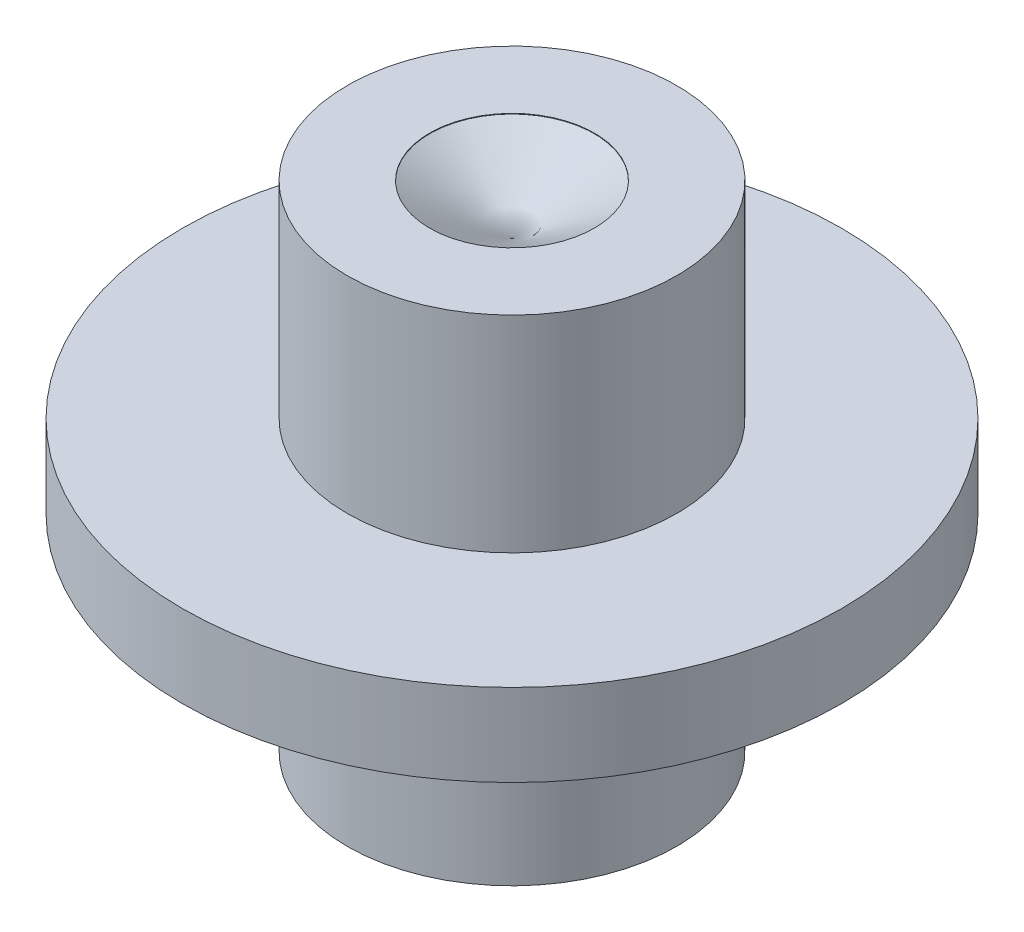
from build123d import *

# Parameters (mm, degrees)
F_1_8_0_125_DIAMETER_HOLE1_D     = 3.175
F_1_8_0_125_DIAMETER_HOLE1_DEPTH = 0.011333767
F_1_8_0_125_DIAMETER_HOLE1_TIP   = 0.953866233


with BuildPart() as part:
    # Sketch1 → Revolve1 (revolve)
    with BuildSketch(Plane.XY, mode=Mode.PRIVATE) as revolve1_sk:
        Polygon((0, 4.7625), (3.175, 4.7625), (3.175, 0.79375), (6.35, 0.79375), (6.35, -0.79375), (3.175, -0.79375), (3.175, -4.7625), (0, -4.7625), align=None)
    revolve(revolve1_sk.sketch.rotate(Axis((0, 4.7625, 0), (0, -1, 0)), 90), axis=Axis((0, 4.7625, 0), (0, -1, 0)))

    # 1/8 (0.125) Diameter Hole1
    with Locations(Plane(origin=(0, 4.7625, 0), x_dir=(1, 0, 0), z_dir=(0, 1, 0))):
        with Locations((0, 0)):
            Hole(F_1_8_0_125_DIAMETER_HOLE1_D / 2, depth=F_1_8_0_125_DIAMETER_HOLE1_DEPTH)
            with Locations((0, 0, -(F_1_8_0_125_DIAMETER_HOLE1_DEPTH + F_1_8_0_125_DIAMETER_HOLE1_TIP / 2))):  # 118° drill point
                Cone(0, F_1_8_0_125_DIAMETER_HOLE1_D / 2, F_1_8_0_125_DIAMETER_HOLE1_TIP, mode=Mode.SUBTRACT)


solid = part.part
